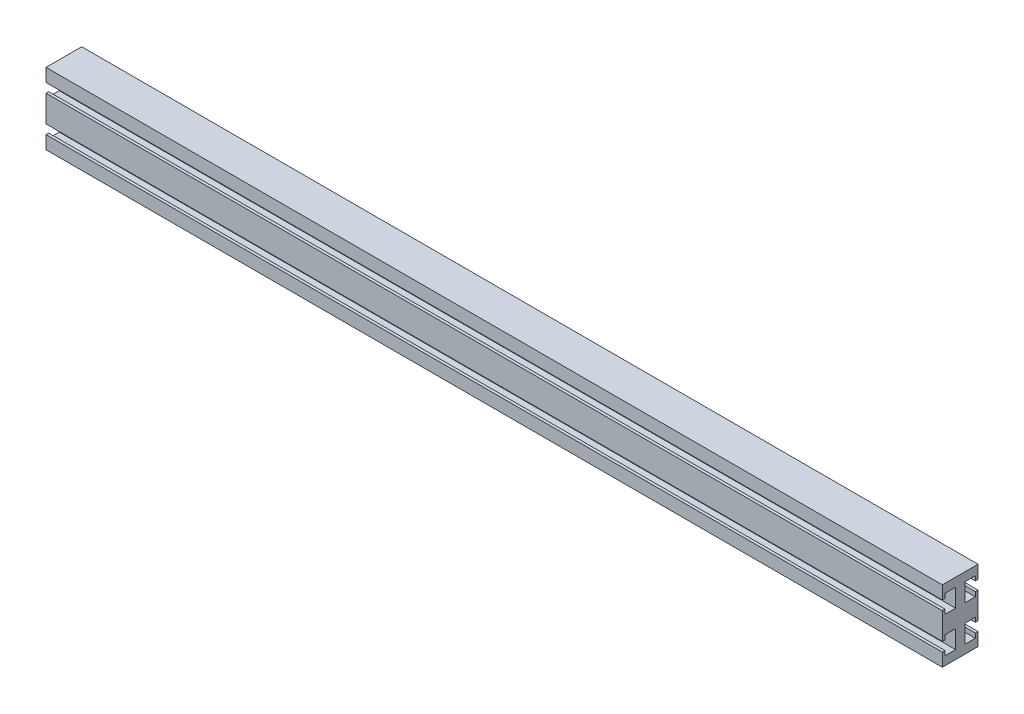
from build123d import *

# Parameters (mm, degrees)
SKETCH1_W            = 500
SKETCH1_H            = 19.9
BOSS_EXTRUDE1_DEPTH  = 19.91
CUT_EXTRUDE1_DEPTH   = 501.495165411
MIRROR2_COPY_1_DEPTH = 501.495165411


with BuildPart() as part:
    # Sketch1 → Boss-Extrude1 (new, symmetric)
    with BuildSketch(Plane(origin=(0, 0, 0), x_dir=(1, 0, 0), z_dir=(0, 1, 0))):
        Rectangle(SKETCH1_W, SKETCH1_H)
    extrude(amount=BOSS_EXTRUDE1_DEPTH, both=True)

    # Sketch2 → Cut-Extrude1 (cut, through all)
    with BuildSketch(Plane(origin=(250, 0, 0), x_dir=(0, 0, -1), z_dir=(1, 0, 0))):
        Polygon((-9.95, 7.42), (-8.45, 7.42), (-8.45, 4.92), (-2.56, 4.92), (-2.56, 15.09), (-8.45, 15.09), (-8.45, 12.59), (-9.95, 12.59), align=None)
    cut_extrude1 = extrude(amount=-CUT_EXTRUDE1_DEPTH, mode=Mode.SUBTRACT)

    # Mirror1: Cut-Extrude1 across plane
    add(cut_extrude1.mirror(Plane.XY), mode=Mode.SUBTRACT)

    # Mirror2: Cut-Extrude1 across plane
    add(cut_extrude1.mirror(Plane.ZX), mode=Mode.SUBTRACT)

    # Mirror2 copy 1 sketch → Mirror2 copy 1 (cut, through all)
    with BuildSketch(Plane(origin=(250, 0, 0), x_dir=(0, 0, 1), z_dir=(1, 0, 0))):
        Polygon((-9.95, 7.42), (-8.45, 7.42), (-8.45, 4.92), (-2.56, 4.92), (-2.56, 15.09), (-8.45, 15.09), (-8.45, 12.59), (-9.95, 12.59), align=None)
    extrude(amount=-MIRROR2_COPY_1_DEPTH, mode=Mode.SUBTRACT)


solid = part.part
